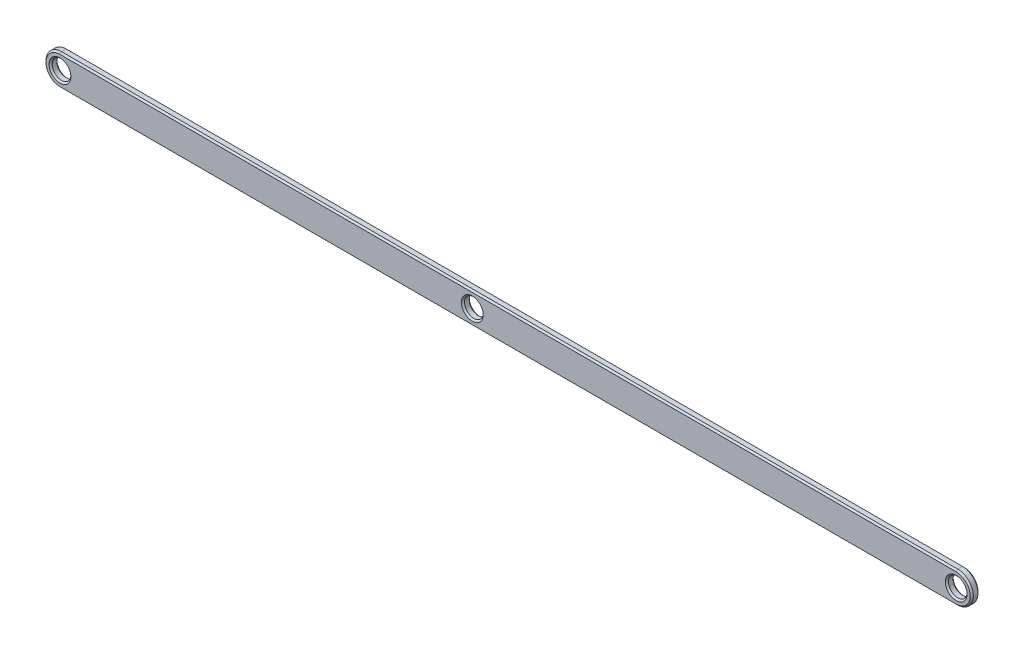
from build123d import *

# Parameters (mm, degrees)
SKETCH1_R           = 30
BOSS_EXTRUDE1_DEPTH = 25
CHAMFER1_SIZE       = 5


with BuildPart() as part:
    # Sketch1 → Boss-Extrude1 (new body)
    with BuildSketch(Plane.XY):
        with BuildLine():
            Line((1440, -50), (-1440, -50))
            ThreePointArc((-1440, -50), (-1490, 0), (-1440, 50))
            Line((-1440, 50), (1440, 50))
            ThreePointArc((1440, 50), (1490, 0), (1440, -50))
        make_face()
        with Locations((-1440, 0)):
            Circle(SKETCH1_R, mode=Mode.SUBTRACT)
        with Locations(Location((1440, 0, 0), (0, 0, 180))):
            Circle(SKETCH1_R, mode=Mode.SUBTRACT)
        with Locations((-115, 0)):
            Circle(SKETCH1_R, mode=Mode.SUBTRACT)
    extrude(amount=BOSS_EXTRUDE1_DEPTH)

    # Chamfer1
    chamfer1_edges = [part.edges().sort_by_distance(p)[0] for p in [
        (1490, 0, 25),
        (-1470, 0, 0),
        (-1470, 0, 25),
        (0, 50, 25),
        (1470, 0, 0),
        (1470, 0, 25),
        (-145, 0, 0),
        (-145, 0, 25),
        (-1490, 0, 25),
        (0, 50, 0),
        (1490, 0, 0),
        (0, -50, 0),
        (-1490, 0, 0),
        (0, -50, 25),
    ]]
    chamfer(chamfer1_edges, length=CHAMFER1_SIZE)


solid = part.part
